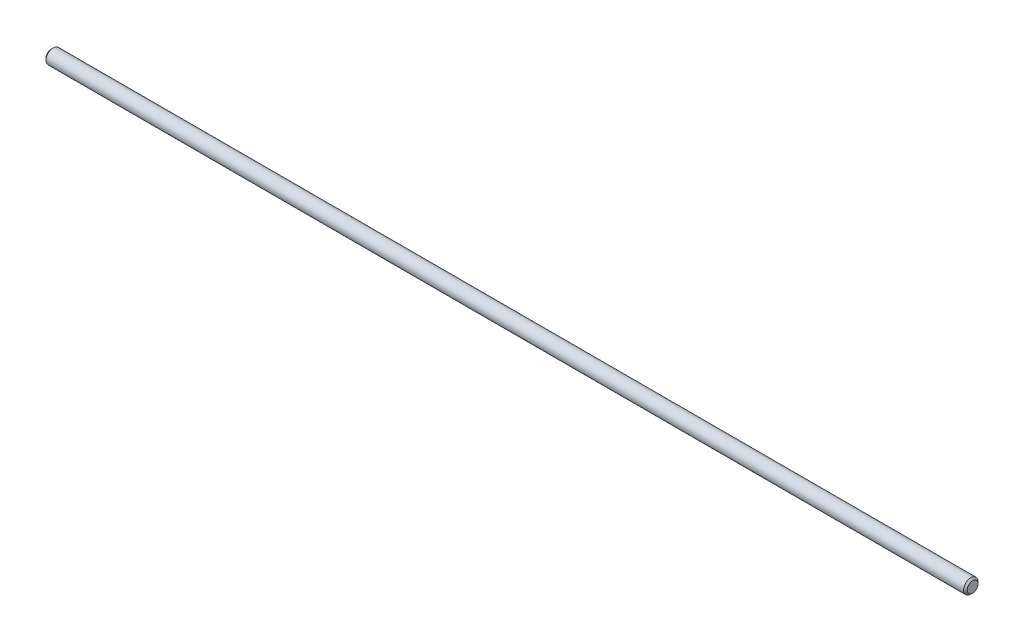
from build123d import *

# Parameters (mm, degrees)
SKETCH2_R           = 4.7625
BOSS_EXTRUDE1_DEPTH = 609.6
CHAMFER1_SIZE       = 1.190625


with BuildPart() as part:
    # Sketch2 → Boss-Extrude1 (new body)
    with BuildSketch(Plane(origin=(0, 0, 0), x_dir=(0, 0, -1), z_dir=(1, 0, 0))):
        Circle(SKETCH2_R)
    extrude(amount=-BOSS_EXTRUDE1_DEPTH)

    # Chamfer1
    chamfer1_edges = [part.edges().sort_by_distance(p)[0] for p in [
        (0, 0, 4.7625),
        (-609.6, 0, 4.7625),
    ]]
    chamfer(chamfer1_edges, length=CHAMFER1_SIZE)


solid = part.part
